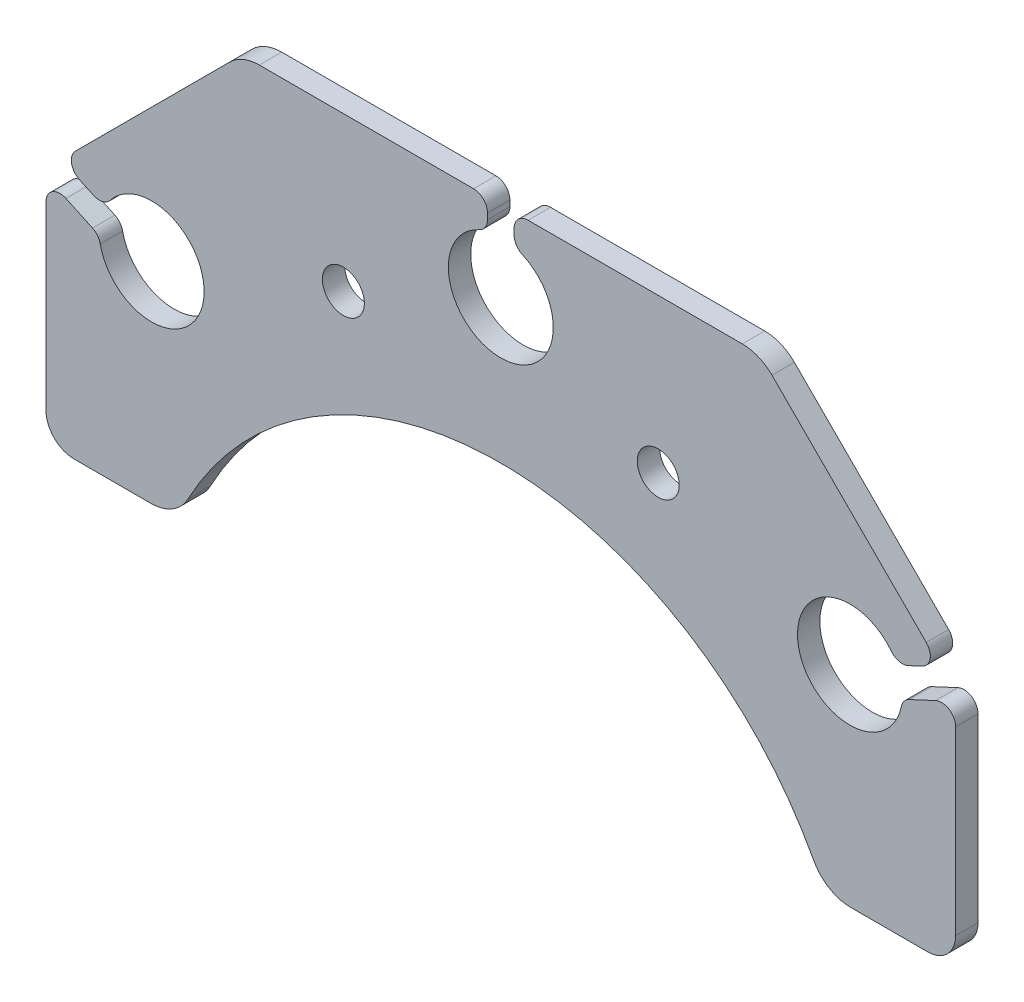
from build123d import *

# Parameters (mm, degrees)
IZIM1_R                     = 1.5
Y_KSEKLIK_EKSTR_ZYON1_DEPTH = 1.6


with BuildPart() as part:
    # Çizim1 → Yükseklik-Ekstrüzyon1 (new body)
    with BuildSketch(Plane.XY):
        with BuildLine():
            Line((51.878679656, -0.878679656), (62.901413512, -11.901413512))
            ThreePointArc((62.901413512, -11.901413512), (63.179114484, -12.782168471), (62.616924992, -13.51482808))
            Line((62.616924992, -13.51482808), (61.615557944, -13.981773203))
            ThreePointArc((61.615557944, -13.981773203), (60.959512838, -14.047839782), (60.404952381, -13.691156907))
            ThreePointArc((60.404952381, -13.691156907), (53.799180994, -16.856750014), (61.123557768, -16.753308252))
            ThreePointArc((61.123557768, -16.753308252), (61.318334892, -16.334489822), (61.680554911, -16.047882666))
            Line((61.680554911, -16.047882666), (63.577381738, -15.16337779))
            ThreePointArc((63.577381738, -15.16337779), (64.537299608, -15.226294131), (65, -16.069685577))
            Line((65, -16.069685577), (65, -29))
            ThreePointArc((65, -29), (64.414213562, -30.414213562), (63, -31))
            Line((63, -31), (57.505773979, -31))
            ThreePointArc((57.505773979, -31), (55.962548796, -30.572636009), (54.859002861, -29.412304022))
            ThreePointArc((54.859002861, -29.412304022), (32.5, -16), (10.140997139, -29.412304022))
            ThreePointArc((10.140997139, -29.412304022), (9.037451204, -30.572636009), (7.494226021, -31))
            Line((7.494226021, -31), (2, -31))
            ThreePointArc((2, -31), (0.585786438, -30.414213562), (0, -29))
            Line((0, -29), (0, -16.069685577))
            ThreePointArc((0, -16.069685577), (0.462700392, -15.226294131), (1.422618262, -15.16337779))
            Line((1.422618262, -15.16337779), (3.319445089, -16.047882666))
            ThreePointArc((3.319445089, -16.047882666), (3.681665108, -16.334489822), (3.876442232, -16.753308252))
            ThreePointArc((3.876442232, -16.753308252), (11.200819006, -16.856750014), (4.595047619, -13.691156907))
            ThreePointArc((4.595047619, -13.691156907), (4.040487162, -14.047839782), (3.384442056, -13.981773203))
            Line((3.384442056, -13.981773203), (2.383075008, -13.51482808))
            ThreePointArc((2.383075008, -13.51482808), (1.820885516, -12.782168471), (2.098586488, -11.901413512))
            Line((2.098586488, -11.901413512), (13.121320344, -0.878679656))
            ThreePointArc((13.121320344, -0.878679656), (14.09459039, -0.228361402), (15.242640687, 0))
            Line((15.242640687, 0), (30.55, 0))
            ThreePointArc((30.55, 0), (31.257106781, -0.292893219), (31.55, -1))
            Line((31.55, -1), (31.55, -1.418718434))
            ThreePointArc((31.55, -1.418718434), (31.389799475, -1.961615148), (30.960526316, -2.330567185))
            ThreePointArc((30.960526316, -2.330567185), (32.5, -9.5), (34.039473684, -2.330567185))
            ThreePointArc((34.039473684, -2.330567185), (33.610200525, -1.961615148), (33.45, -1.418718434))
            Line((33.45, -1.418718434), (33.45, -1))
            ThreePointArc((33.45, -1), (33.742893219, -0.292893219), (34.45, 0))
            Line((34.45, 0), (49.757359313, 0))
            ThreePointArc((49.757359313, 0), (50.90540961, -0.228361402), (51.878679656, -0.878679656))
        make_face()
        with Locations((21.25, -11)):
            Circle(IZIM1_R, mode=Mode.SUBTRACT)
        with Locations((43.75, -11)):
            Circle(IZIM1_R, mode=Mode.SUBTRACT)
    extrude(amount=Y_KSEKLIK_EKSTR_ZYON1_DEPTH)


solid = part.part
